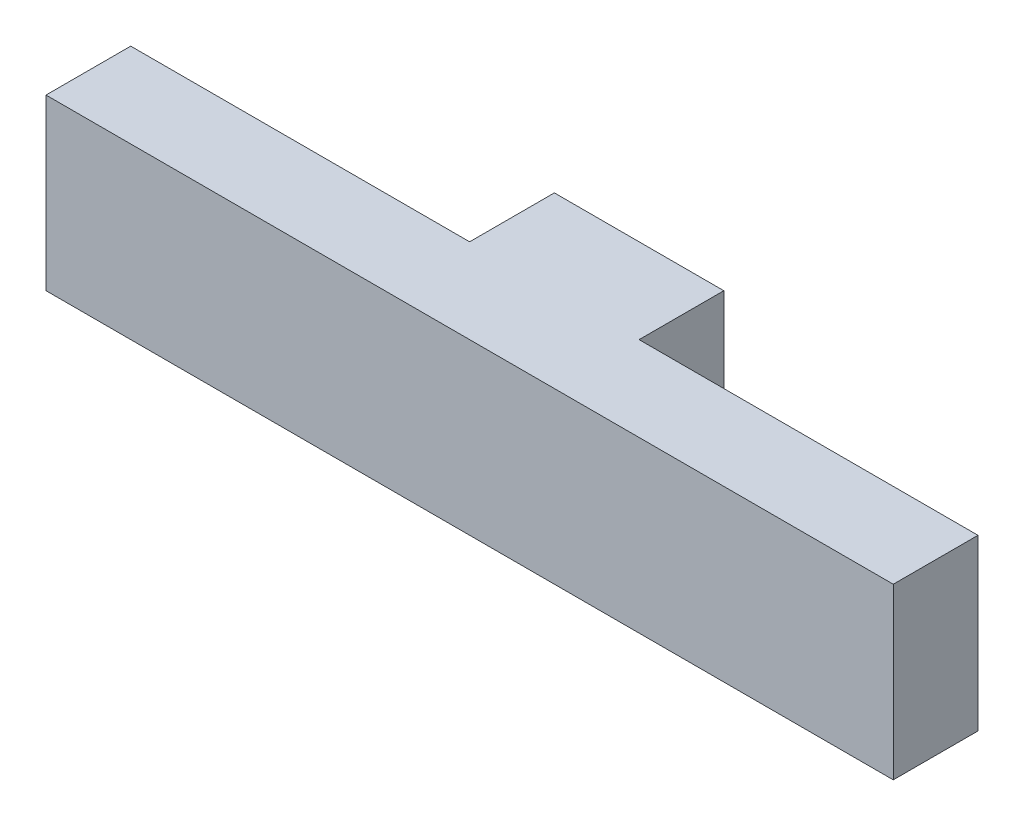
from build123d import *

# Parameters (mm, degrees)
BOSS_EXTRUDE1_DEPTH = 20


with BuildPart() as part:
    # Sketch2 → Boss-Extrude1 (new body)
    with BuildSketch(Plane(origin=(0, 0, 0), x_dir=(1, 0, 0), z_dir=(0, 1, 0))):
        Polygon((50, -20), (-50, -20), (-50, -10), (-10, -10), (-10, 0), (10, 0), (10, -10), (50, -10), align=None)
    extrude(amount=BOSS_EXTRUDE1_DEPTH)


solid = part.part
